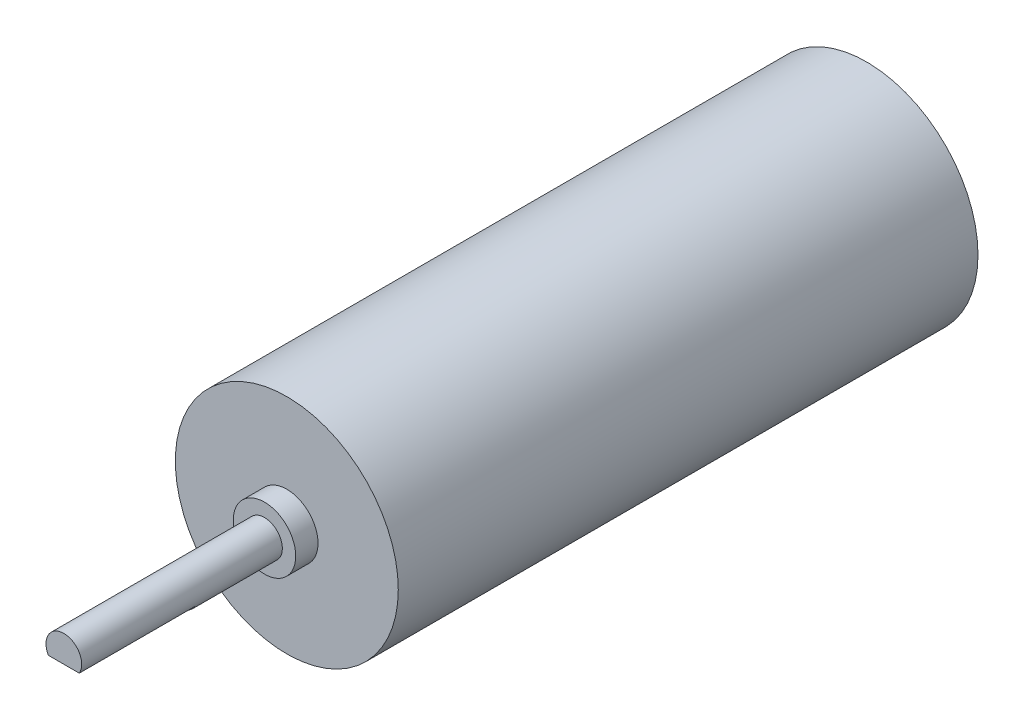
from build123d import *

# Parameters (mm, degrees)
ESQUISSE1_R             = 12.5
BOSS_EXTRU_1_DEPTH      = 65
ESQUISSE2_R             = 3.5
BOSS_EXTRU_2_DEPTH      = 2.5
ESQUISSE3_R             = 2
BOSS_EXTRU_3_DEPTH      = 22.5
ENL_V_START             = -13
ENL_V_MAT_EXTRU_1_DEPTH = 13


with BuildPart() as part:
    # Esquisse1 → Boss.-Extru.1 (new body)
    with BuildSketch(Plane.XY):
        Circle(ESQUISSE1_R)
    extrude(amount=-BOSS_EXTRU_1_DEPTH)

    # Esquisse2 → Boss.-Extru.2 (add)
    with BuildSketch(Plane.XY):
        Circle(ESQUISSE2_R)
    extrude(amount=BOSS_EXTRU_2_DEPTH)

    # Esquisse3 → Boss.-Extru.3 (add)
    with BuildSketch(Plane.XY.offset(2.5)):
        Circle(ESQUISSE3_R)
    extrude(amount=BOSS_EXTRU_3_DEPTH)

    # Esquisse4 → Enlèv. mat.-Extru.1 (cut)
    with BuildSketch(Plane.XY.offset(25).offset(ENL_V_START)):
        with BuildLine():
            Line((-1.732050808, -1), (1.732050808, -1))
            ThreePointArc((1.732050808, -1), (0, -2), (-1.732050808, -1))
        make_face()
    extrude(amount=ENL_V_MAT_EXTRU_1_DEPTH, mode=Mode.SUBTRACT)


solid = part.part
